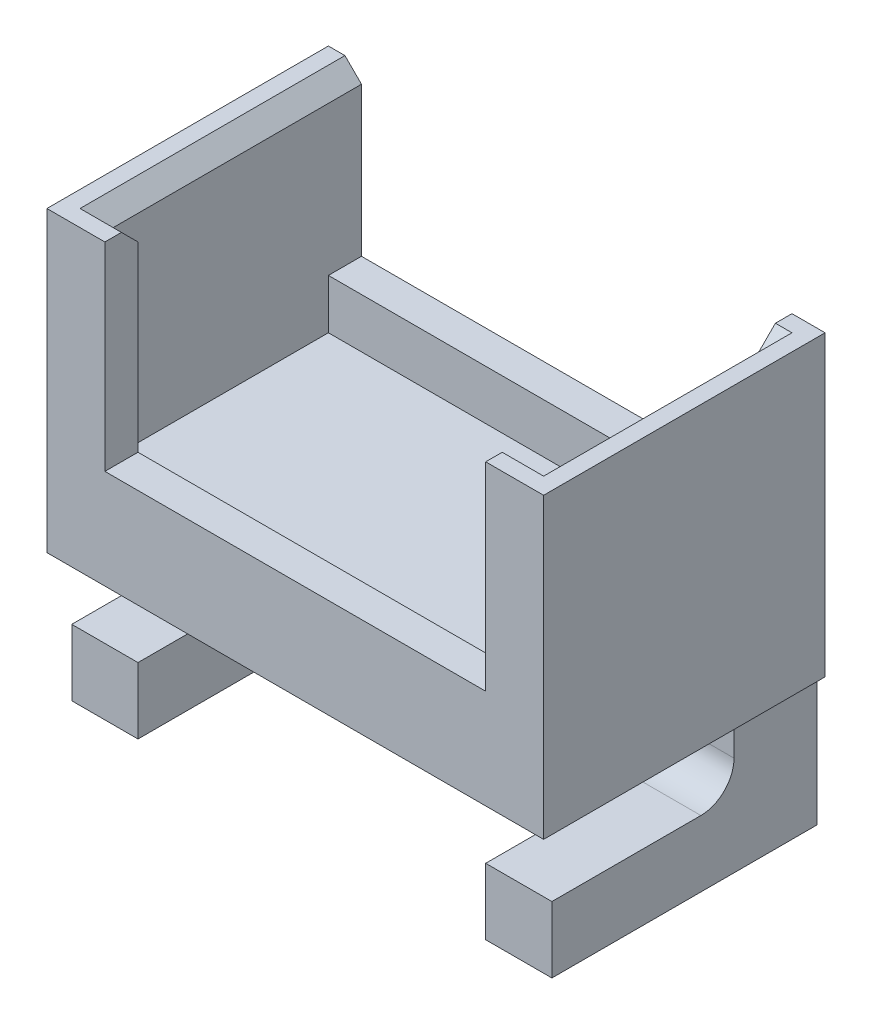
from build123d import *

# Parameters (mm, degrees)
SKETCH_2_W          = 30
SKETCH_2_H          = 17
EXTRUDE_1_DEPTH     = 2
SKETCH_2_3_W        = 30
SKETCH_2_3_H        = 17
SKETCH_2_3_W_2      = 26
SKETCH_2_3_H_2      = 13
EXTRUDE_2_DEPTH     = 15
CUT_EXTRUDE_1_REACH = 29.185
SKETCH_3_W          = 23
SKETCH_3_H          = 12
CUT_EXTRUDE_2_REACH = 27.981
SKETCH_4_W          = 12
SKETCH_4_H          = 6
CHAMFER_2_SIZE      = 1
SKETCH_5_W          = 30
SKETCH_5_H          = 17
EXTRUDE_3_DEPTH     = 3
EXTRUDE_4_DEPTH     = 4
SKETCH_7_W          = 4
SKETCH_7_H          = 4
EXTRUDE_5_DEPTH     = 16
FILLET_1_R          = 2
CUT_EXTRUDE_3_DEPTH = 10


with BuildPart() as part:
    # 草图2 → 凸台-拉伸1 (new body)
    with BuildSketch(Plane(origin=(0, 0, 0), x_dir=(1, 0, 0), z_dir=(0, 1, 0))):
        Rectangle(SKETCH_2_W, SKETCH_2_H)
    extrude(amount=EXTRUDE_1_DEPTH)

    # 草图2<3> → 凸台-拉伸2 (add)
    with BuildSketch(Plane(origin=(0, 0, 0), x_dir=(1, 0, 0), z_dir=(0, 1, 0))):
        Rectangle(SKETCH_2_3_W, SKETCH_2_3_H)
        Rectangle(SKETCH_2_3_W_2, SKETCH_2_3_H_2, mode=Mode.SUBTRACT)
    extrude(amount=EXTRUDE_2_DEPTH)

    # 草图3 → 切除-拉伸1 (cut, up to next)
    with BuildSketch(Plane.XY.offset(8.5), mode=Mode.PRIVATE) as cut_extrude_1_sk1:
        with Locations((0, 9)):
            Rectangle(SKETCH_3_W, SKETCH_3_H)
    cut_extrude_1_tool1 = extrude(cut_extrude_1_sk1.sketch, amount=-CUT_EXTRUDE_1_REACH, mode=Mode.PRIVATE) & part.part
    add(cut_extrude_1_tool1.solids().sort_by_distance((0, 9, 8.5))[0], mode=Mode.SUBTRACT)

    # 草图4 → 切除-拉伸2 (cut, up to next)
    with BuildSketch(Plane.XY.offset(-6.5), mode=Mode.PRIVATE) as cut_extrude_2_sk1:
        with Locations((-7, 12)):
            Rectangle(SKETCH_4_W, SKETCH_4_H)
    cut_extrude_2_tool1 = extrude(cut_extrude_2_sk1.sketch, amount=-CUT_EXTRUDE_2_REACH, mode=Mode.PRIVATE) & part.part
    add(cut_extrude_2_tool1.solids().sort_by_distance((-7, 12, -6.5))[0], mode=Mode.SUBTRACT)

    # 倒角2
    chamfer_2_edges = [part.edges().sort_by_distance(p)[0] for p in [
        (-13, 15, -1),
        (-12.25, 15, 6.5),
        (12.25, 15, 6.5),
        (6, 15, -6.5),
        (13, 15, 0),
    ]]
    chamfer(chamfer_2_edges, length=CHAMFER_2_SIZE)

    # 草图5 → 凸台-拉伸3 (add)
    with BuildSketch(Plane.XZ):
        Rectangle(SKETCH_5_W, SKETCH_5_H)
    extrude(amount=EXTRUDE_3_DEPTH)

    # 草图6 → 凸台-拉伸4 (add)
    with BuildSketch(Plane.XZ.offset(3)):
        Polygon((-12.5, -3.5), (-10.5, -3.5), (-10.5, -8.5), (-14.5, -8.5), (-14.5, -3.5), align=None)
    extrude_4 = extrude(amount=EXTRUDE_4_DEPTH)

    # 草图7 → 凸台-拉伸5 (add)
    with BuildSketch(Plane(origin=(0, 0, -8.5), x_dir=(-1, 0, 0), z_dir=(0, 0, -1))):
        with Locations((12.5, -9)):
            Rectangle(SKETCH_7_W, SKETCH_7_H)
    extrude_5 = extrude(amount=-EXTRUDE_5_DEPTH)

    # 镜向1: 凸台-拉伸4, 凸台-拉伸5 across plane
    add(extrude_4.mirror(Plane(origin=(0, 0, 0), x_dir=(0, 0, 1), z_dir=(1, 0, 0))))
    add(extrude_5.mirror(Plane(origin=(0, 0, 0), x_dir=(0, 0, 1), z_dir=(1, 0, 0))))

    # 圆角1
    fillet_1_edges = [part.edges().sort_by_distance(p)[0] for p in [
        (12.5, -7, -3.5),
        (-12.5, -7, -3.5),
    ]]
    fillet(fillet_1_edges, radius=FILLET_1_R)

    # 草图8 → 切除-拉伸3 (cut)
    with BuildSketch(Plane(origin=(0, 15, 0), x_dir=(1, 0, 0), z_dir=(0, 1, 0))):
        Polygon((13, 6.5), (13, 9.517493256), (-13, 9.517493256), (-13, 5.799908087), (12.835608811, 5.799908087), align=None)
    extrude(amount=-CUT_EXTRUDE_3_DEPTH, mode=Mode.SUBTRACT)


solid = part.part
